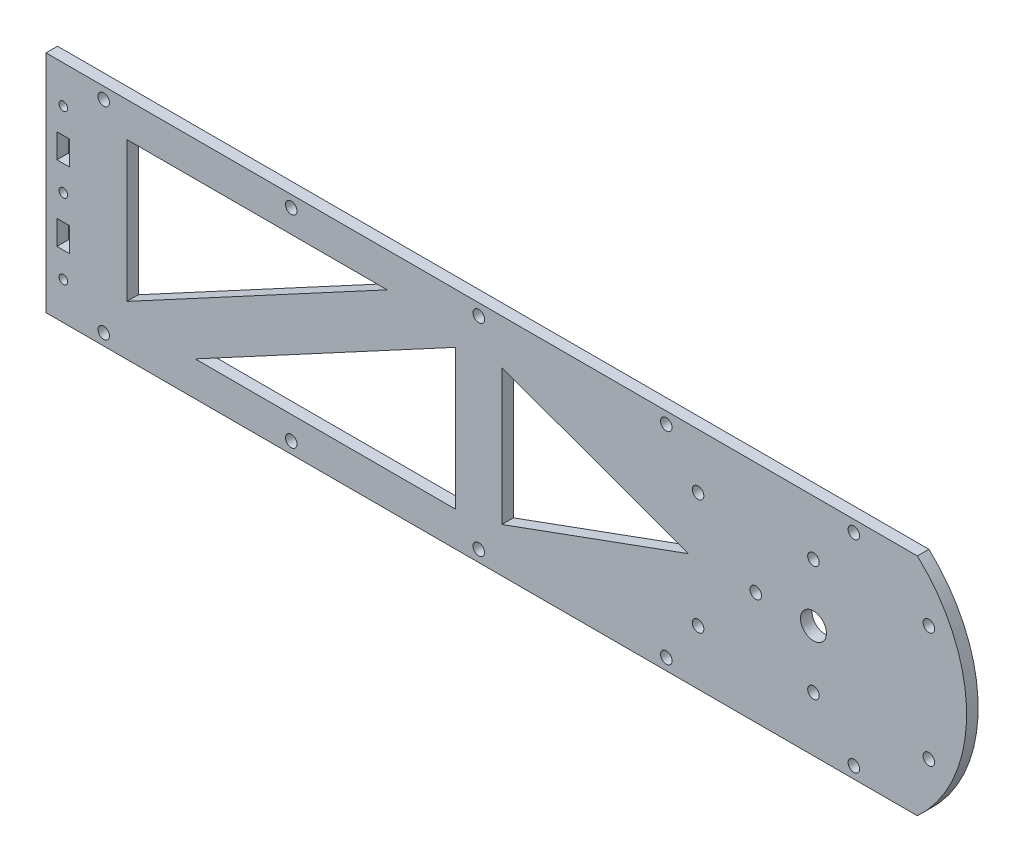
from build123d import *

# Parameters (mm, degrees)
SKETCH_1_R      = 1.5
SKETCH_1_R_2    = 4.5
SKETCH_1_R_3    = 2
SKETCH_1_W      = 4.4
SKETCH_1_H      = 8.4
EXTRUDE_1_DEPTH = 4


with BuildPart() as part:
    # 草图1 → 凸台-拉伸1 (new body)
    with BuildSketch(Plane.XY):
        with BuildLine():
            Line((-6, 39), (-6, -39))
            Line((-6, -39), (296.024297356, -39))
            ThreePointArc((296.024297356, -39), (313.091901454, 0), (296.024297356, 39))
            Line((296.024297356, 39), (-6, 39))
        make_face()
        Circle(SKETCH_1_R, mode=Mode.SUBTRACT)
        with Locations(Location((0, 26, 0), (0, 0, 180))):
            Circle(SKETCH_1_R, mode=Mode.SUBTRACT)
        with Locations((0, -26)):
            Circle(SKETCH_1_R, mode=Mode.SUBTRACT)
        with Locations((260, 0)):
            Circle(SKETCH_1_R_2, mode=Mode.SUBTRACT)
        with Locations((260, 20)):
            Circle(SKETCH_1_R_3, mode=Mode.SUBTRACT)
        with Locations((240, 0)):
            Circle(SKETCH_1_R_3, mode=Mode.SUBTRACT)
        with Locations((300, 20)):
            Circle(SKETCH_1_R_3, mode=Mode.SUBTRACT)
        with Locations((300, -20)):
            Circle(SKETCH_1_R_3, mode=Mode.SUBTRACT)
        with Locations((220, 20)):
            Circle(SKETCH_1_R_3, mode=Mode.SUBTRACT)
        with Locations((220, -20)):
            Circle(SKETCH_1_R_3, mode=Mode.SUBTRACT)
        with Locations((260, -20)):
            Circle(SKETCH_1_R_3, mode=Mode.SUBTRACT)
        with Locations((274, -35)):
            Circle(SKETCH_1_R_3, mode=Mode.SUBTRACT)
        with Locations((209, -35)):
            Circle(SKETCH_1_R_3, mode=Mode.SUBTRACT)
        with Locations((144, -35)):
            Circle(SKETCH_1_R_3, mode=Mode.SUBTRACT)
        with Locations((79, -35)):
            Circle(SKETCH_1_R_3, mode=Mode.SUBTRACT)
        with Locations((14, -35)):
            Circle(SKETCH_1_R_3, mode=Mode.SUBTRACT)
        with Locations((209, 35)):
            Circle(SKETCH_1_R_3, mode=Mode.SUBTRACT)
        with Locations((144, 35)):
            Circle(SKETCH_1_R_3, mode=Mode.SUBTRACT)
        with Locations((79, 35)):
            Circle(SKETCH_1_R_3, mode=Mode.SUBTRACT)
        with Locations((14, 35)):
            Circle(SKETCH_1_R_3, mode=Mode.SUBTRACT)
        with Locations((274, 35)):
            Circle(SKETCH_1_R_3, mode=Mode.SUBTRACT)
        with Locations((0, 13)):
            Rectangle(SKETCH_1_W, SKETCH_1_H, mode=Mode.SUBTRACT)
        with Locations((0, -13)):
            Rectangle(SKETCH_1_W, SKETCH_1_H, mode=Mode.SUBTRACT)
        Polygon((22, -21.606262732), (112.268773645, 27), (22, 27), align=None, mode=Mode.SUBTRACT)
        Polygon((45.731226355, -27), (136, -27), (136, 21.606262732), align=None, mode=Mode.SUBTRACT)
        Polygon((152, -23.568232368), (216.644294496, 0), (152, 23.568232368), align=None, mode=Mode.SUBTRACT)
    extrude(amount=EXTRUDE_1_DEPTH)


solid = part.part
